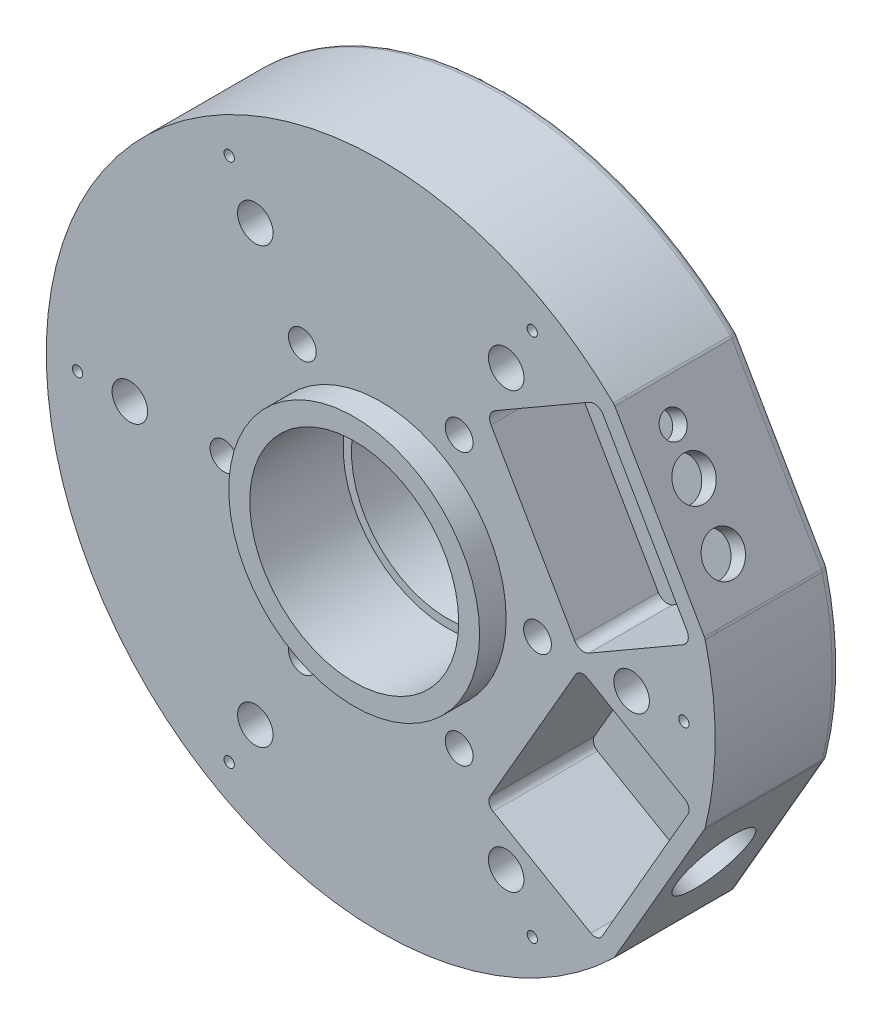
from build123d import *

# Parameters (mm, degrees)
BOSS_EXTRUDE1_DEPTH                      = 29.999999999999996
CUT_EXTRUDE1_DEPTH                       = 2.8000000000000003
CUT_EXTRUDE2_DEPTH                       = 2.8000000000000003
CUT_EXTRUDE3_DEPTH                       = 2.8000000000000003
CUT_EXTRUDE4_DEPTH                       = 2.8000000000000003
CUT_EXTRUDE5_DEPTH                       = 25
CUT_EXTRUDE6_DEPTH                       = 19.999999999999996
CBORE_FOR_M8_HEX_HEAD_BOLT1_D            = 8.5
CBORE_FOR_M8_HEX_HEAD_BOLT1_CBORE_D      = 14
CBORE_FOR_M8_HEX_HEAD_BOLT1_CBORE_DEPTH  = 9
CBORE_FOR_M42_HEX_HEAD_BOLT1_D           = 46
CBORE_FOR_M42_HEX_HEAD_BOLT1_CBORE_D     = 60
CBORE_FOR_M42_HEX_HEAD_BOLT1_CBORE_DEPTH = 16
M6_CLEARANCE_HOLE1_D                     = 6.647
F_18_0_18_DIAMETER_HOLE1_D               = 18
F_18_0_18_DIAMETER_HOLE1_DEPTH           = 4
F_6_0_6_DIAMETER_HOLE1_D                 = 6
F_6_0_6_DIAMETER_HOLE1_DEPTH             = 4
F_9_5_9_5_DIAMETER_HOLE1_D               = 9.5
F_9_5_9_5_DIAMETER_HOLE1_DEPTH           = 4
M2_CLEARANCE_HOLE1_D                     = 2.459
M2_CLEARANCE_HOLE1_DEPTH                 = 11.999999999
M2_CLEARANCE_HOLE1_TIP                   = 0.7387581310943854
FILLET1_R                                = 2
FILLET2_R                                = 2.5
BOSS_EXTRUDE2_START                      = 22.35
SKETCH24_R                               = 30
SKETCH24_R_2                             = 25
BOSS_EXTRUDE2_DEPTH                      = 22.35


with BuildPart() as part:
    # Sketch1 → Boss-Extrude1 (new body)
    with BuildSketch(Plane.XY.offset(30)):
        with BuildLine():
            Line((77.53522329850713, 19.70505387078747), (55.83268888429636, 57.29494612921257))
            ThreePointArc((55.83268888429636, 57.29494612921257), (-80, -6.126e-14), (55.83268888429644, -57.2949461292125))
            Line((55.83268888429644, -57.2949461292125), (77.53522329850712, -19.705053870787513))
            ThreePointArc((77.53522329850712, -19.705053870787513), (80, -2.22e-14), (77.53522329850713, 19.70505387078747))
        make_face()
    extrude(amount=-BOSS_EXTRUDE1_DEPTH)

    # Sketch2 → Cut-Extrude1 (cut)
    with BuildSketch(Plane.XY.offset(30)):
        with BuildLine():
            Line((77.39609873421605, -19.946024684720538), (77.53522329850712, -19.705053870787513))
            ThreePointArc((77.53522329850712, -19.705053870787513), (77.56980781474408, -19.568467379528453), (77.60415171963812, -19.431820189456964))
            ThreePointArc((77.60415171963812, -19.431820189456964), (77.51803860039408, -19.696170391673196), (77.39609873421605, -19.946024684720538))
        make_face()
    extrude(amount=-CUT_EXTRUDE1_DEPTH, mode=Mode.SUBTRACT)

    # Sketch3 → Cut-Extrude2 (cut)
    with BuildSketch(Plane.XY.offset(30)):
        with BuildLine():
            Line((55.971813448587454, 57.05397531527954), (55.83268888429636, 57.29494612921257))
            ThreePointArc((55.83268888429636, 57.29494612921257), (55.73169377117071, 57.39319044448088), (55.630525785660076, 57.49125673362003))
            ThreePointArc((55.630525785660076, 57.49125673362003), (55.81640321665286, 57.28450548364745), (55.971813448587454, 57.05397531527954))
        make_face()
    extrude(amount=-CUT_EXTRUDE2_DEPTH, mode=Mode.SUBTRACT)

    # Sketch4 → Cut-Extrude3 (cut)
    with BuildSketch(Plane.XY.offset(30)):
        with BuildLine():
            Line((55.83268888429644, -57.2949461292125), (55.971813448587504, -57.05397531527945))
            ThreePointArc((55.971813448587504, -57.05397531527945), (55.816403216652915, -57.284505483647365), (55.63052578566014, -57.491256733619956))
            ThreePointArc((55.63052578566014, -57.491256733619956), (55.73169377117078, -57.3931904444808), (55.83268888429644, -57.2949461292125))
        make_face()
    extrude(amount=-CUT_EXTRUDE3_DEPTH, mode=Mode.SUBTRACT)

    # Sketch5 → Cut-Extrude4 (cut)
    with BuildSketch(Plane.XY.offset(30)):
        with BuildLine():
            Line((77.53522329850713, 19.70505387078747), (77.39609873421605, 19.94602468472051))
            ThreePointArc((77.39609873421605, 19.94602468472051), (77.51803860039408, 19.696170391673164), (77.60415171963812, 19.43182018945693))
            ThreePointArc((77.60415171963812, 19.43182018945693), (77.56980781474407, 19.56846737952841), (77.53522329850713, 19.70505387078747))
        make_face()
    extrude(amount=-CUT_EXTRUDE4_DEPTH, mode=Mode.SUBTRACT)

    # Sketch6 → Cut-Extrude5 (cut)
    with BuildSketch(Plane.XY.offset(30)):
        Polygon((51.969854476264025, -55.985571585149884), (74.46985447626403, -17.014428414850173), (47.62306695894643, -1.5144284148501383), (25.123066958946435, -40.4855715851499), align=None)
    extrude(amount=-CUT_EXTRUDE5_DEPTH, mode=Mode.SUBTRACT)

    # Sketch7 → Cut-Extrude6 (cut)
    with BuildSketch(Plane.XY.offset(30)):
        Polygon((51.96985447626403, 55.98557158514987), (25.12306695894642, 40.48557158514987), (47.62306695894643, 1.5144284148501332), (74.46985447626402, 17.014428414850116), align=None)
    extrude(amount=-CUT_EXTRUDE6_DEPTH, mode=Mode.SUBTRACT)

    # CBORE for M8 Hex Head Bolt1 (through all)
    with Locations(Plane(origin=(0, 0, 0), x_dir=(-1, 0, 0), z_dir=(0, 0, -1))):
        with Locations((30, -51.961524227), (-30, -51.961524227), (-60, 0), (-30, 51.961524227), (30, 51.961524227), (60, 0)):
            CounterBoreHole(CBORE_FOR_M8_HEX_HEAD_BOLT1_D / 2, CBORE_FOR_M8_HEX_HEAD_BOLT1_CBORE_D / 2, CBORE_FOR_M8_HEX_HEAD_BOLT1_CBORE_DEPTH)

    # CBORE for M42 Hex Head Bolt1 (through all)
    with Locations(Plane.XY.offset(30)):
        with Locations((0, 0)):
            CounterBoreHole(CBORE_FOR_M42_HEX_HEAD_BOLT1_D / 2, CBORE_FOR_M42_HEX_HEAD_BOLT1_CBORE_D / 2, CBORE_FOR_M42_HEX_HEAD_BOLT1_CBORE_DEPTH)

    # M6 Clearance Hole1 (through all)
    with Locations(Plane(origin=(0, 0, 0), x_dir=(-1, 0, 0), z_dir=(0, 0, -1))):
        with Locations((18.75, 32.475952642), (-18.75, 32.475952642), (-37.5, 0), (-18.75, -32.475952642), (18.75, -32.475952642), (37.5, 0)):
            Hole(M6_CLEARANCE_HOLE1_D / 2)

    # Ø18.0 (18) Diameter Hole1
    with Locations(Plane(origin=(66.6839560914018, -38.499999999999986, 0), x_dir=(0, 0, -1), z_dir=(0.8660254037844387, -0.49999999999999983, 0))):
        with Locations((-17, 0)):
            Hole(F_18_0_18_DIAMETER_HOLE1_D / 2, depth=F_18_0_18_DIAMETER_HOLE1_DEPTH)

    # Ø6.0 (6) Diameter Hole1
    with Locations(Plane(origin=(66.68395609140181, 38.50000000000004, 0), x_dir=(0, 0, -1), z_dir=(0.8660254037844385, 0.5000000000000006, 0))):
        with Locations((-20, 13.5)):
            Hole(F_6_0_6_DIAMETER_HOLE1_D / 2, depth=F_6_0_6_DIAMETER_HOLE1_DEPTH)

    # Ø9.5 (9.5) Diameter Hole1
    with Locations(Plane(origin=(66.68395609140181, 38.50000000000004, 0), x_dir=(0, 0, -1), z_dir=(0.8660254037844385, 0.5000000000000006, 0))):
        with Locations((-20, 3.5), (-20, -10.5)):
            Hole(F_9_5_9_5_DIAMETER_HOLE1_D / 2, depth=F_9_5_9_5_DIAMETER_HOLE1_DEPTH)

    # M2 Clearance Hole1
    with Locations(Plane.XY.offset(30)):
        with Locations((-36.25, -62.786841774), (-72.5, 0), (-36.25, 62.786841774), (36.25, 62.786841774), (72.5, 0), (36.25, -62.786841774)):
            Hole(M2_CLEARANCE_HOLE1_D / 2, depth=M2_CLEARANCE_HOLE1_DEPTH)
            with Locations((0, 0, -(M2_CLEARANCE_HOLE1_DEPTH + M2_CLEARANCE_HOLE1_TIP / 2))):  # 118° drill point
                Cone(0, M2_CLEARANCE_HOLE1_D / 2, M2_CLEARANCE_HOLE1_TIP, mode=Mode.SUBTRACT)

    # Fillet1
    fillet1_edges = [part.edges().sort_by_distance(p)[0] for p in [
        (25.123066958946435, -40.4855715851499, 17.5),
        (74.46985447626403, -17.014428414850173, 17.5),
        (77.53522329850713, -19.705053870787516, 13.600000000000001),
        (80, -1.688e-14, 3.55e-15),
        (77.53522329850713, 19.705053870787474, 13.600000000000001),
        (55.83268888429644, -57.294946129212505, 13.600000000000001),
        (55.83268888429636, 57.29494612921257, 13.600000000000001),
        (66.68395609140178, -38.50000000000001, 3.55e-15),
        (66.68395609140174, 38.500000000000014, 3.55e-15),
        (-80, -5.684e-14, 3.55e-15),
        (51.969854476264025, -55.985571585149884, 17.5),
        (47.62306695894643, -1.5144284148501383, 17.5),
    ]]
    fillet(fillet1_edges, radius=FILLET1_R)

    # Fillet2
    fillet2_edges = [part.edges().sort_by_distance(p)[0] for p in [
        (51.96985447626403, 55.98557158514987, 20),
        (74.46985447626402, 17.014428414850116, 20),
        (47.62306695894643, 1.5144284148501332, 20),
        (25.12306695894642, 40.48557158514987, 20),
    ]]
    fillet(fillet2_edges, radius=FILLET2_R)

    # Sketch24 → Boss-Extrude2 (add)
    with BuildSketch(Plane.XY.offset(13.999999999999998).offset(BOSS_EXTRUDE2_START)):
        Circle(SKETCH24_R)
        Circle(SKETCH24_R_2, mode=Mode.SUBTRACT)
    extrude(amount=-BOSS_EXTRUDE2_DEPTH)


solid = part.part
